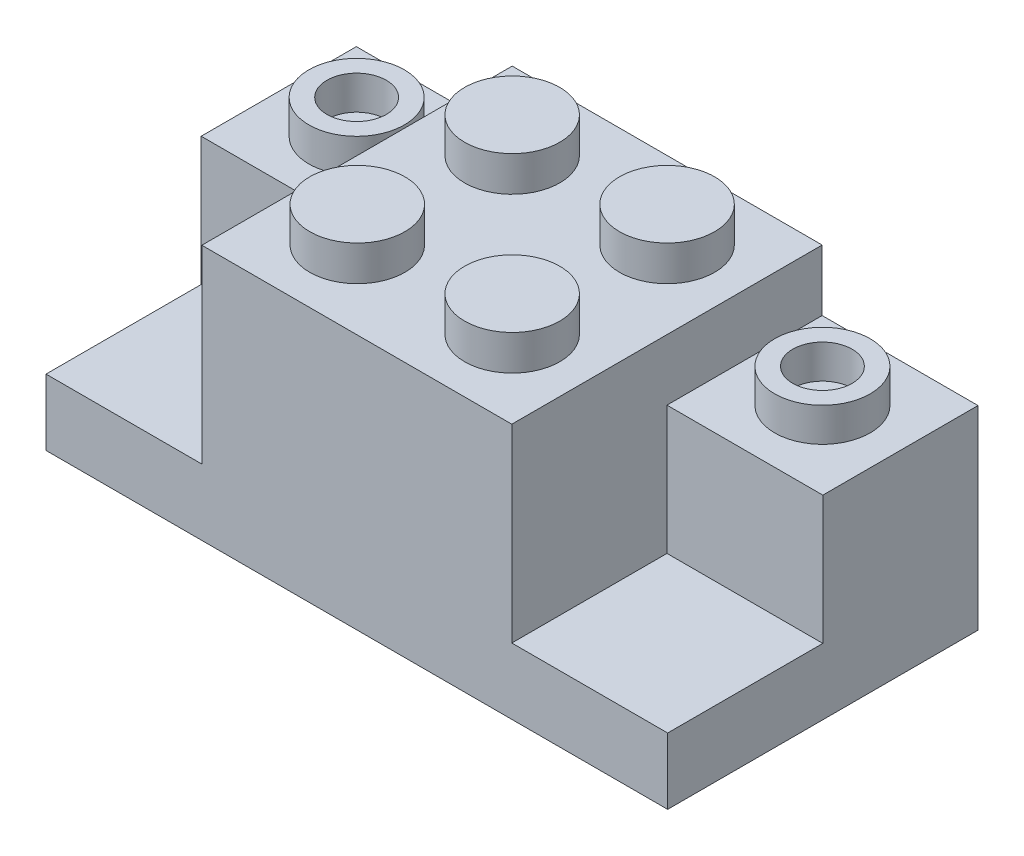
from build123d import *

# Parameters (mm, degrees)
BOSS_EXTRUDE2_DEPTH = 15.95
SKETCH2_R           = 2.445
BOSS_EXTRUDE3_DEPTH = 1.81
SKETCH3_W           = 8.01
SKETCH3_H           = 7.975
BOSS_EXTRUDE4_DEPTH = 6.6
SKETCH4_R           = 2.455
SKETCH4_R_2         = 1.525
BOSS_EXTRUDE5_DEPTH = 1.74


with BuildPart() as part:
    # Sketch1 → Boss-Extrude2 (new body)
    with BuildSketch(Plane.XY):
        Polygon((-7.965, 9.74), (7.965, 9.74), (7.965, 0), (15.975, 0), (15.975, -3.4), (-15.975, -3.4), (-15.975, 0), (-7.965, 0), align=None)
    extrude(amount=-BOSS_EXTRUDE2_DEPTH)

    # Sketch2 → Boss-Extrude3 (add)
    with BuildSketch(Plane(origin=(0, 9.74, 0), x_dir=(1, 0, 0), z_dir=(0, 1, 0))):
        with Locations(Location((-3.985, 11.97, 0), (0, 0, 270))):
            Circle(SKETCH2_R)
        with Locations(Location((3.975, 11.97, 0), (0, 0, 270))):
            Circle(SKETCH2_R)
        with Locations(Location((3.975, 4.01, 0), (0, 0, 270))):
            Circle(SKETCH2_R)
        with Locations(Location((-3.985, 4.01, 0), (0, 0, 270))):
            Circle(SKETCH2_R)
    extrude(amount=BOSS_EXTRUDE3_DEPTH)

    # Sketch3 → Boss-Extrude4 (add)
    with BuildSketch(Plane(origin=(0, 0, 0), x_dir=(1, 0, 0), z_dir=(0, 1, 0))):
        with Locations((-11.97, 11.9625)):
            Rectangle(SKETCH3_W, SKETCH3_H)
        with Locations((11.97, 11.9625)):
            Rectangle(SKETCH3_W, SKETCH3_H)
    extrude(amount=BOSS_EXTRUDE4_DEPTH)

    # Sketch4 → Boss-Extrude5 (add)
    # profile 1 of 2: a face of its own
    with BuildSketch(Plane(origin=(0, 6.6, 0), x_dir=(1, 0, 0), z_dir=(0, 1, 0))):
        with Locations(Location((11.97, 11.96, 0), (0, 0, 270))):
            Circle(SKETCH4_R)
        with Locations(Location((11.97, 11.96, 0), (0, 0, 270))):
            Circle(SKETCH4_R_2, mode=Mode.SUBTRACT)
    # profile 2 of 2: a face of its own
    with BuildSketch(Plane(origin=(0, 6.6, 0), x_dir=(1, 0, 0), z_dir=(0, 1, 0))):
        with Locations(Location((-11.97, 11.96, 0), (0, 0, 90))):
            Circle(SKETCH4_R)
        with Locations(Location((-11.97, 11.96, 0), (0, 0, 90))):
            Circle(SKETCH4_R_2, mode=Mode.SUBTRACT)
    extrude(amount=BOSS_EXTRUDE5_DEPTH)


solid = part.part
